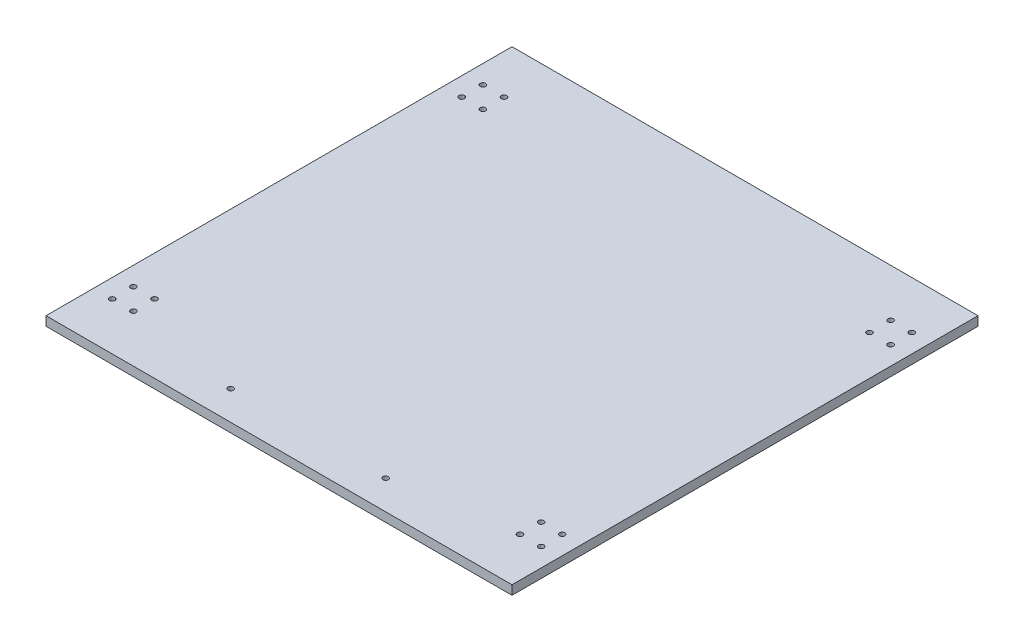
from build123d import *

# Parameters (mm, degrees)
SKETCH1_W           = 304.8
SKETCH1_H           = 304.8
SKETCH1_R           = 1.778
SKETCH1_R_2         = 1.764026957
BOSS_EXTRUDE1_DEPTH = 5.9944


with BuildPart() as part:
    # Sketch1 → Boss-Extrude1 (new body)
    with BuildSketch(Plane(origin=(0, 0, 0), x_dir=(1, 0, 0), z_dir=(0, 1, 0))):
        Rectangle(SKETCH1_W, SKETCH1_H)
        with Locations(Location((-140.264797213, 121.214797213, 0), (0, 0, 90))):
            Circle(SKETCH1_R, mode=Mode.SUBTRACT)
        with Locations(Location((-140.264797213, 107.385202787, 0), (0, 0, 90))):
            Circle(SKETCH1_R, mode=Mode.SUBTRACT)
        with Locations(Location((-126.435202787, 107.385202787, 0), (0, 0, 90))):
            Circle(SKETCH1_R, mode=Mode.SUBTRACT)
        with Locations(Location((-126.435202787, 121.214797213, 0), (0, 0, 90))):
            Circle(SKETCH1_R, mode=Mode.SUBTRACT)
        with Locations(Location((-140.264797213, -121.214797213, 0), (0, 0, 90))):
            Circle(SKETCH1_R, mode=Mode.SUBTRACT)
        with Locations(Location((-126.435202787, -121.214797213, 0), (0, 0, 90))):
            Circle(SKETCH1_R, mode=Mode.SUBTRACT)
        with Locations(Location((-126.435202787, -107.385202787, 0), (0, 0, 90))):
            Circle(SKETCH1_R, mode=Mode.SUBTRACT)
        with Locations(Location((-140.264797213, -107.385202787, 0), (0, 0, 90))):
            Circle(SKETCH1_R, mode=Mode.SUBTRACT)
        with Locations(Location((126.435202787, 121.214797213, 0), (0, 0, 90))):
            Circle(SKETCH1_R_2, mode=Mode.SUBTRACT)
        with Locations(Location((140.264797213, 121.214797213, 0), (0, 0, 90))):
            Circle(SKETCH1_R_2, mode=Mode.SUBTRACT)
        with Locations(Location((140.264797213, 107.385202787, 0), (0, 0, 90))):
            Circle(SKETCH1_R_2, mode=Mode.SUBTRACT)
        with Locations(Location((126.435202787, 107.385202787, 0), (0, 0, 90))):
            Circle(SKETCH1_R_2, mode=Mode.SUBTRACT)
        with Locations(Location((-50.689968624, -133.35, 0), (0, 0, 90))):
            Circle(SKETCH1_R, mode=Mode.SUBTRACT)
        with Locations(Location((126.435202787, -107.385202787, 0), (0, 0, 90))):
            Circle(SKETCH1_R, mode=Mode.SUBTRACT)
        with Locations(Location((126.435202787, -121.214797213, 0), (0, 0, 90))):
            Circle(SKETCH1_R, mode=Mode.SUBTRACT)
        with Locations(Location((140.264797213, -121.214797213, 0), (0, 0, 90))):
            Circle(SKETCH1_R, mode=Mode.SUBTRACT)
        with Locations(Location((140.264797213, -107.385202787, 0), (0, 0, 90))):
            Circle(SKETCH1_R, mode=Mode.SUBTRACT)
        with Locations(Location((50.689968624, -133.35, 0), (0, 0, 90))):
            Circle(SKETCH1_R, mode=Mode.SUBTRACT)
    extrude(amount=BOSS_EXTRUDE1_DEPTH)


solid = part.part
